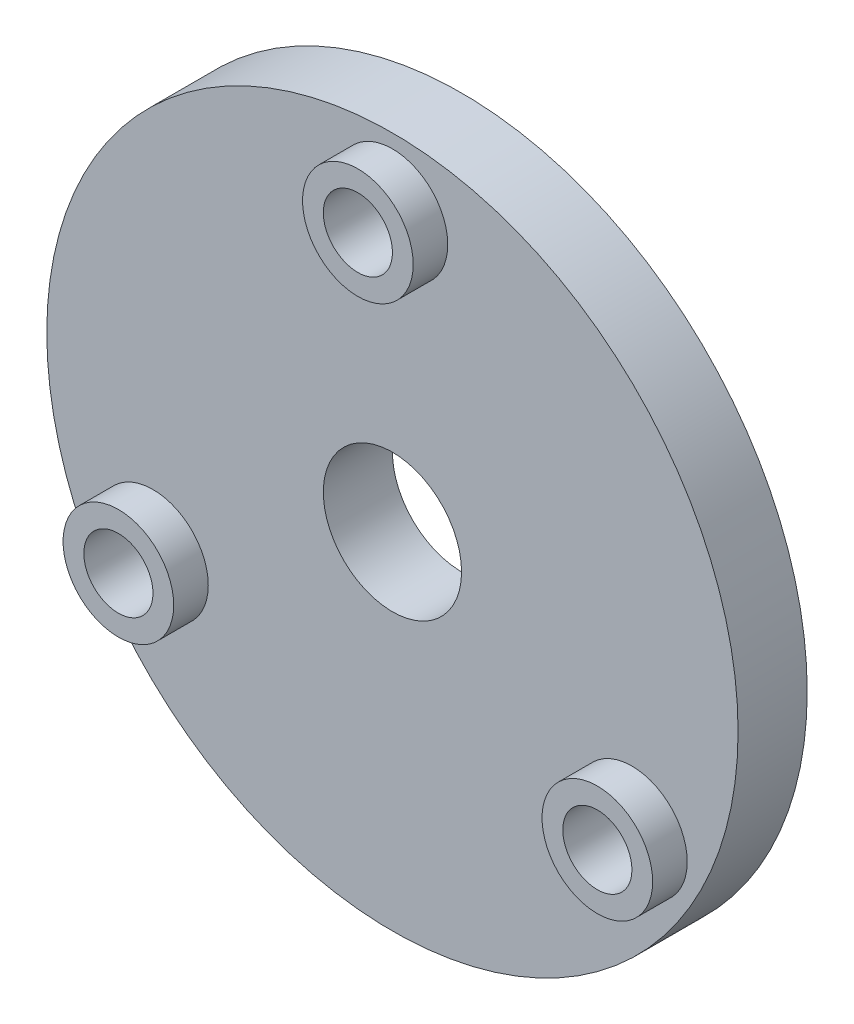
from build123d import *

# Parameters (mm, degrees)
SKETCH1_R           = 50
SKETCH1_R_2         = 10
BOSS_EXTRUDE2_DEPTH = 10
SKETCH3_R           = 5
CUT_EXTRUDE2_DEPTH  = 10
CIRPATTERN1_COUNT   = 3
SKETCH4_R           = 8
SKETCH4_R_2         = 5
BOSS_EXTRUDE3_DEPTH = 5
CIRPATTERN2_COUNT   = 3


with BuildPart() as part:
    # Sketch1 → Boss-Extrude2 (new body)
    with BuildSketch(Plane.XY):
        Circle(SKETCH1_R)
        Circle(SKETCH1_R_2, mode=Mode.SUBTRACT)
    extrude(amount=BOSS_EXTRUDE2_DEPTH)

    # Sketch3 → Cut-Extrude2 (cut)
    with BuildSketch(Plane.XY):
        with Locations((0, 40)):
            Circle(SKETCH3_R)
    cut_extrude2 = extrude(amount=CUT_EXTRUDE2_DEPTH, mode=Mode.SUBTRACT)

    # CirPattern1: Cut-Extrude2 ×3 about axis
    cirpattern1_axis = Axis((0, 0, 0), (0, 0, 1))
    for i in range(1, CIRPATTERN1_COUNT):
        add(cut_extrude2.rotate(cirpattern1_axis, i * 360 / CIRPATTERN1_COUNT), mode=Mode.SUBTRACT)

    # Sketch4 → Boss-Extrude3 (add)
    with BuildSketch(Plane.XY.offset(10)):
        with Locations((0, 40)):
            Circle(SKETCH4_R)
        with Locations((0, 40)):
            Circle(SKETCH4_R_2, mode=Mode.SUBTRACT)
    boss_extrude3 = extrude(amount=BOSS_EXTRUDE3_DEPTH)

    # CirPattern2: Boss-Extrude3 ×3 about axis
    cirpattern2_axis = Axis((0, 0, 0), (0, 0, 1))
    for i in range(1, CIRPATTERN2_COUNT):
        add(boss_extrude3.rotate(cirpattern2_axis, i * 360 / CIRPATTERN2_COUNT))


solid = part.part
